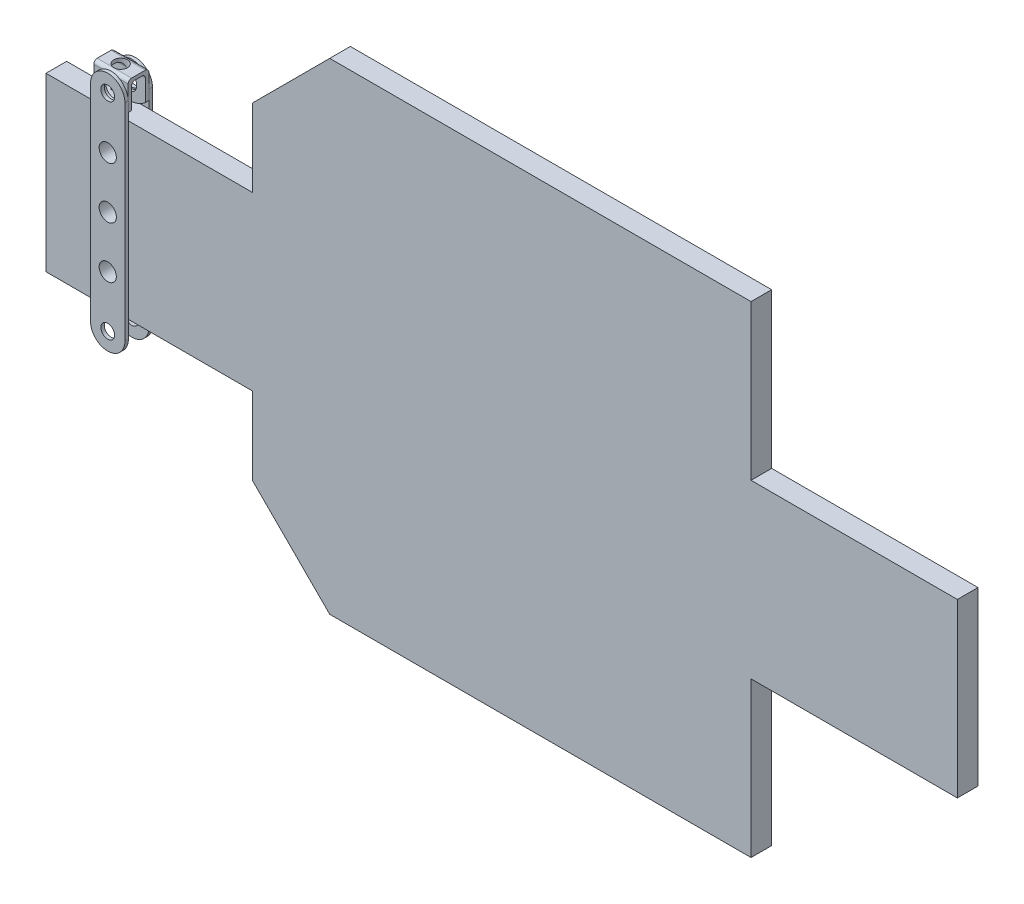
from build123d import *

# Parameters (mm, degrees)
EXTRUDE_2_DEPTH        = 6
EXTRUDE_3_DEPTH        = 1
PATTERN_LINEAR_1_COUNT = 2
PATTERN_LINEAR_1_PITCH = 7
SKETCH_12_2_R          = 2
SKETCH_12_2_R_2        = 2.5
CUT_EXTRUDE_2_DEPTH    = 31
CUT_EXTRUDE_START      = -31
SKETCH_12_3_R          = 2
SKETCH_12_3_R_2        = 2.5
CUT_EXTRUDE_3_DEPTH    = 31
EXTRUDE_4_DEPTH        = 0.0001
EXTRUDE_4_DEPTH_BACK   = 10
SKETCH_15_6_R          = 2.5
CUT_EXTRUDE_21_DEPTH   = 30
CUT_EXTRUDE_25_DEPTH   = 30
SKETCH_37_R            = 2
CUT_EXTRUDE_28_DEPTH   = 150


with BuildPart() as part:
    # Эскиз4<2> → Бобышка-Вытянуть2 (new body)
    with BuildSketch(Plane.XY):
        Polygon((0, 0), (0, 50), (60, 50), (60, 72.5), (82.5, 95), (205, 95), (205, 50), (265, 50), (265, 0), (205, 0), (205, -45), (82.5, -45), (60, -22.5), (60, 0), align=None)
    extrude(amount=EXTRUDE_2_DEPTH)

    # Эскиз7<2> → Бобышка-Вытянуть3 (add)
    with BuildSketch(Plane.XY):
        with BuildLine():
            Line((13.95, 55), (13.95, -5))
            ThreePointArc((13.95, -5), (18.95, -10), (23.95, -5))
            Line((23.95, -5), (23.95, 55))
            ThreePointArc((23.95, 55), (18.95, 60), (13.95, 55))
        make_face()
    extrude_3 = extrude(amount=-EXTRUDE_3_DEPTH)

    # Линейный массив1: Бобышка-Вытянуть3 ×2
    with Locations(*[(0, 0, i * PATTERN_LINEAR_1_PITCH) for i in range(1, PATTERN_LINEAR_1_COUNT)]):
        add(extrude_3)

    # Эскиз12<2> → Вырез-Вытянуть2 (cut)
    with BuildSketch(Plane.XY):
        with Locations((18.95, 55)):
            Circle(SKETCH_12_2_R)
        with Locations((18.95, 25)):
            Circle(SKETCH_12_2_R_2)
        with Locations((18.95, 10)):
            Circle(SKETCH_12_2_R_2)
        with Locations((18.95, -5)):
            Circle(SKETCH_12_2_R)
        with Locations((18.95, 40)):
            Circle(SKETCH_12_2_R_2)
    extrude(amount=CUT_EXTRUDE_2_DEPTH, mode=Mode.SUBTRACT)

    # Эскиз12<3> → Вырез-Вытянуть3 (cut)
    with BuildSketch(Plane.XY.offset(CUT_EXTRUDE_START)):
        with Locations((18.95, 55)):
            Circle(SKETCH_12_3_R)
        with Locations((18.95, 40)):
            Circle(SKETCH_12_3_R_2)
        with Locations((18.95, 25)):
            Circle(SKETCH_12_3_R_2)
        with Locations((18.95, 10)):
            Circle(SKETCH_12_3_R_2)
        with Locations((18.95, -5)):
            Circle(SKETCH_12_3_R)
    extrude(amount=CUT_EXTRUDE_3_DEPTH, mode=Mode.SUBTRACT)


with BuildPart() as body_2:
    # Эскиз14 → Бобышка-Вытянуть4 (new, two sides: drawn at the far end of the back side and taken through both)
    with BuildSketch(Plane(origin=(13.95, 61.855423186, -9.080381405), x_dir=(0, 0, 1), z_dir=(-1, 0, 0)).offset(-EXTRUDE_4_DEPTH_BACK)):
        with BuildLine():
            Line((9.143949682, -11.564188361), (9.143949682, -6.564188361))
            Line((9.143949682, -6.564188361), (9.143949682, -2.564188361))
            ThreePointArc((9.143949682, -2.564188361), (9.4368429, -1.85708158), (10.143949682, -1.564188361))
            Line((10.143949682, -1.564188361), (14.143949682, -1.564188361))
            ThreePointArc((14.143949682, -1.564188361), (14.851056463, -1.85708158), (15.143949682, -2.564188361))
            Line((15.143949682, -2.564188361), (15.143949682, -11.564188361))
            Line((15.143949682, -11.564188361), (14.143949682, -11.564188361))
            Line((14.143949682, -11.564188361), (14.143949682, -3.564188361))
            ThreePointArc((14.143949682, -3.564188361), (13.851056463, -2.85708158), (13.143949682, -2.564188361))
            Line((13.143949682, -2.564188361), (11.143949682, -2.564188361))
            ThreePointArc((11.143949682, -2.564188361), (10.4368429, -2.85708158), (10.143949682, -3.564188361))
            Line((10.143949682, -3.564188361), (10.143949682, -11.564188361))
            Line((10.143949682, -11.564188361), (9.143949682, -11.564188361))
        make_face()
    extrude(amount=EXTRUDE_4_DEPTH + EXTRUDE_4_DEPTH_BACK)

    # Эскиз15<6> → Вырез-Вытянуть21 (cut)
    with BuildSketch(Plane(origin=(13.95, 55.158060944, 6.063568276), x_dir=(1, 0, 0), z_dir=(0, 0, 1))):
        with Locations((5, 0)):
            Circle(SKETCH_15_6_R)
    extrude(amount=-CUT_EXTRUDE_21_DEPTH, mode=Mode.SUBTRACT)

    # Эскиз36 → Вырез-Вытянуть25 (cut)
    with BuildSketch(Plane.XY):
        with BuildLine():
            Line((13.95, 50.118842572), (13.95, 52.117785958))
            ThreePointArc((13.95, 52.117785958), (18.95, 50.298109491), (23.95, 52.117785958))
            Line((23.95, 52.117785958), (23.95, 50.118842572))
            Line((23.95, 50.118842572), (13.95, 50.118842572))
        make_face()
    extrude(amount=CUT_EXTRUDE_25_DEPTH, mode=Mode.SUBTRACT)

    # Эскиз37 → Вырез-Вытянуть28 (cut)
    with BuildSketch(Plane(origin=(0, 0, 0), x_dir=(1, 0, 0), z_dir=(0, 1, 0))):
        with Locations(Location((18.75, -3.05, 0), (0, 0, 83.322240049))):
            Circle(SKETCH_37_R)
    extrude(amount=CUT_EXTRUDE_28_DEPTH, mode=Mode.SUBTRACT)


solid = Compound([part.part, body_2.part])
